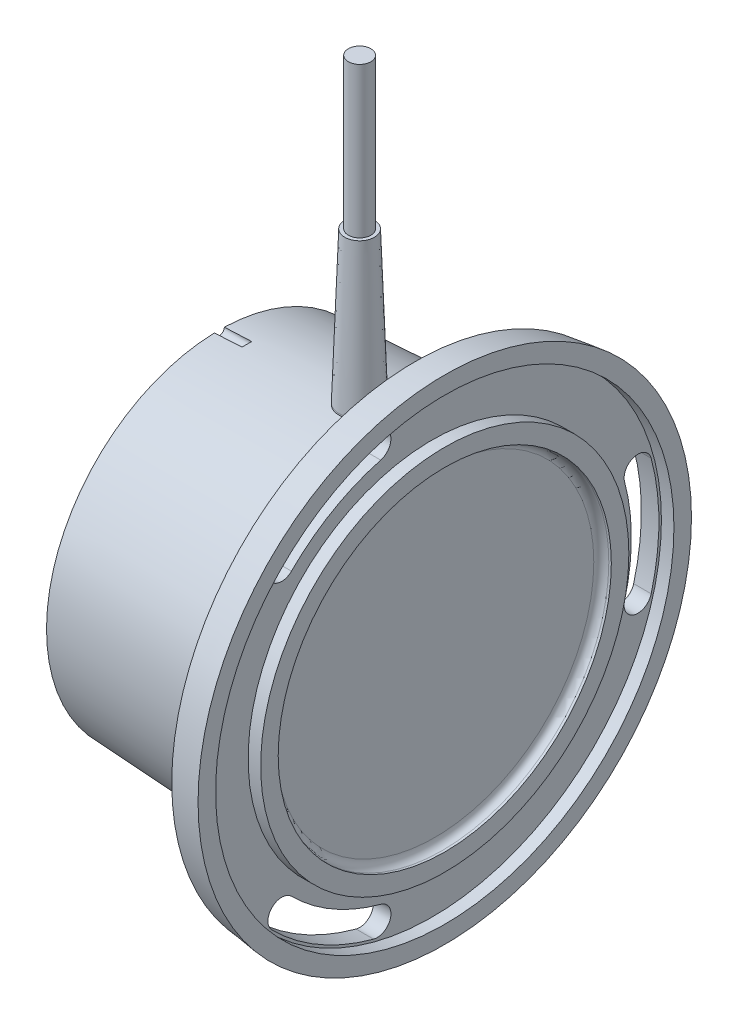
from build123d import *

# Parameters (mm, degrees)
ESQUISSE2_R                  = 1
ENL_V_MAT_EXTRU_1_DEPTH      = 5.5
ESQUISSE3_R                  = 4
EXTRUSION1_DEPTH             = 36
ESQUISSE4_R                  = 4
EXTRUSION2_DEPTH             = 30
EXTRUSION2_TAPER             = 2
ESQUISSE5_R                  = 2.25
EXTRUSION3_DEPTH             = 30
ENL_V_MAT_EXTRU_2_DEPTH      = 115.728211473
R_P_TITION_CIRCULAIRE1_COUNT = 3


with BuildPart() as part:
    # Esquisse1 → Révolution1 (revolve)
    with BuildSketch(Plane.XY, mode=Mode.PRIVATE) as r_volution1_sk:
        with BuildLine():
            Line((0, 0), (0, 34.5))
            Line((0, 34.5), (39, 36.5))
            Line((39, 36.5), (39, 48.5))
            Line((39, 48.5), (45, 49.25))
            Line((45, 49.25), (45, 45.75))
            Line((45, 45.75), (42.5, 45.75))
            Line((42.5, 45.75), (42.5, 36.75))
            Line((42.5, 36.75), (45, 36.75))
            Line((45, 36.75), (45, 33.25))
            Line((45, 33.25), (44.5, 33.25))
            ThreePointArc((44.5, 33.25), (43.439339828, 32.810660172), (43, 31.75))
            Line((43, 31.75), (43, 0))
            Line((43, 0), (0, 0))
        make_face()
    revolve(r_volution1_sk.sketch.rotate(Axis((104.922362869, 0, 0), (-1, 0, 0)), 90), axis=Axis((104.922362869, 0, 0), (-1, 0, 0)))

    # Esquisse2 → Enlèv. mat.-Extru.1 (cut)
    with BuildSketch(Plane.ZY):
        with Locations((0, 34.5)):
            Circle(ESQUISSE2_R)
    extrude(amount=-ENL_V_MAT_EXTRU_1_DEPTH, mode=Mode.SUBTRACT)

    # Esquisse3 → Extrusion1 (add)
    with BuildSketch(Plane(origin=(0, 0, 0), x_dir=(1, 0, 0), z_dir=(0, 1, 0))):
        with Locations((28, 0)):
            Circle(ESQUISSE3_R)
    extrude(amount=EXTRUSION1_DEPTH)

    # Esquisse4 → Extrusion2 (add)
    with BuildSketch(Plane(origin=(0, 36, 0), x_dir=(-1, 0, 0), z_dir=(0, 1, 0))):
        with Locations((-28, 0)):
            Circle(ESQUISSE4_R)
    extrude(amount=EXTRUSION2_DEPTH, taper=EXTRUSION2_TAPER)

    # Esquisse5 → Extrusion3 (add)
    with BuildSketch(Plane(origin=(0, 66, 0), x_dir=(-1, 0, 0), z_dir=(0, 1, 0))):
        with Locations(Location((-28, 0, 0), (0, 0, 90))):
            Circle(ESQUISSE5_R)
    extrude(amount=EXTRUSION3_DEPTH)

    # Esquisse6 → Enlèv. mat.-Extru.2 (cut, through all)
    with BuildSketch(Plane.ZY.offset(-39)):
        with BuildLine():
            ThreePointArc((-38.395503832, 10.288235294), (-40.340031844, 13.656292718), (-43.708089268, 11.711764706))
            ThreePointArc((-43.708089268, 11.711764706), (-45.25, 0), (-43.708089268, -11.711764706))
            ThreePointArc((-43.708089268, -11.711764706), (-40.340031844, -13.656292718), (-38.395503832, -10.288235294))
            ThreePointArc((-38.395503832, -10.288235294), (-39.75, 0), (-38.395503832, 10.288235294))
        make_face()
    enl_v_mat_extru_2 = extrude(amount=-ENL_V_MAT_EXTRU_2_DEPTH, mode=Mode.SUBTRACT)

    # Répétition circulaire1: Enlèv. mat.-Extru.2 ×3 about axis
    r_p_tition_circulaire1_axis = Axis((39, 0, 0), (-1, 0, 0))
    for i in range(1, R_P_TITION_CIRCULAIRE1_COUNT):
        add(enl_v_mat_extru_2.rotate(r_p_tition_circulaire1_axis, i * 360 / R_P_TITION_CIRCULAIRE1_COUNT), mode=Mode.SUBTRACT)


solid = part.part
